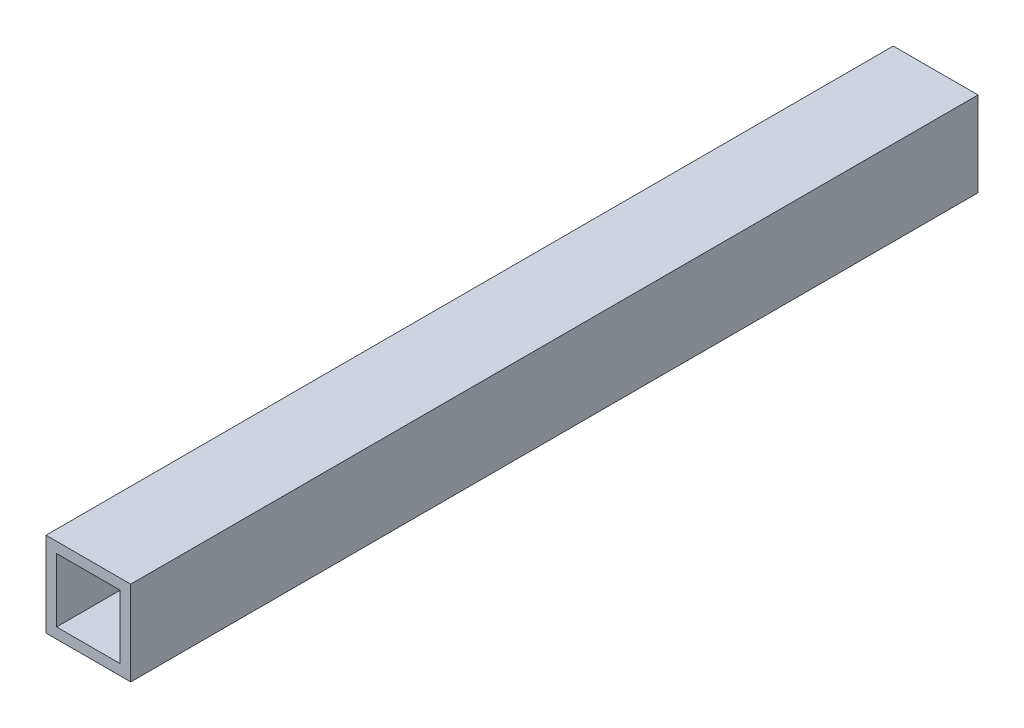
from build123d import *

# Parameters (mm, degrees)
SKETCH1_W           = 25.4
SKETCH1_H           = 25.4
SKETCH1_W_2         = 19.05
SKETCH1_H_2         = 19.05
BOSS_EXTRUDE1_DEPTH = 254


with BuildPart() as part:
    # Sketch1 → Boss-Extrude1 (new body)
    with BuildSketch(Plane.XY):
        with Locations((12.7, -12.7)):
            Rectangle(SKETCH1_W, SKETCH1_H)
        with Locations((12.7, -12.7)):
            Rectangle(SKETCH1_W_2, SKETCH1_H_2, mode=Mode.SUBTRACT)
    extrude(amount=BOSS_EXTRUDE1_DEPTH)


solid = part.part
